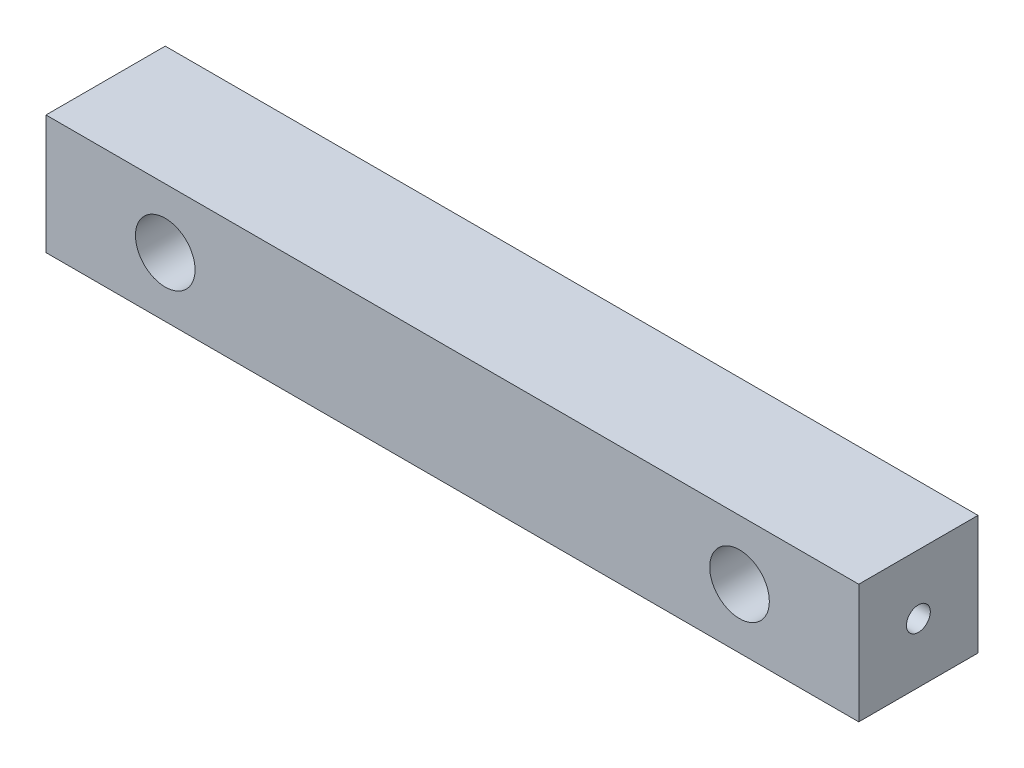
from build123d import *

# Parameters (mm, degrees)
SKETCH1_W           = 136.32
SKETCH1_H           = 20
SKETCH1_R           = 5
BOSS_EXTRUDE1_DEPTH = 20
SKETCH2_R           = 2
CUT_EXTRUDE1_DEPTH  = 7.5
CUT_EXTRUDE2_START  = -7.5
SKETCH3_R           = 2
CUT_EXTRUDE2_DEPTH  = 7.5


with BuildPart() as part:
    # Sketch1 → Boss-Extrude1 (new body)
    with BuildSketch(Plane.XY):
        with Locations((68.16, 10)):
            Rectangle(SKETCH1_W, SKETCH1_H)
        with Locations((116.32, 10)):
            Circle(SKETCH1_R, mode=Mode.SUBTRACT)
        with Locations((20, 10)):
            Circle(SKETCH1_R, mode=Mode.SUBTRACT)
    extrude(amount=BOSS_EXTRUDE1_DEPTH)

    # Sketch2 → Cut-Extrude1 (cut)
    with BuildSketch(Plane.ZY):
        with Locations((10, 10)):
            Circle(SKETCH2_R)
    extrude(amount=-CUT_EXTRUDE1_DEPTH, mode=Mode.SUBTRACT)

    # Sketch3 → Cut-Extrude2 (cut)
    with BuildSketch(Plane(origin=(136.32, 0, 0), x_dir=(0, 0, -1), z_dir=(1, 0, 0)).offset(CUT_EXTRUDE2_START)):
        with Locations(Location((-10, 10, 0), (0, 0, 180))):
            Circle(SKETCH3_R)
    extrude(amount=CUT_EXTRUDE2_DEPTH, mode=Mode.SUBTRACT)


solid = part.part
